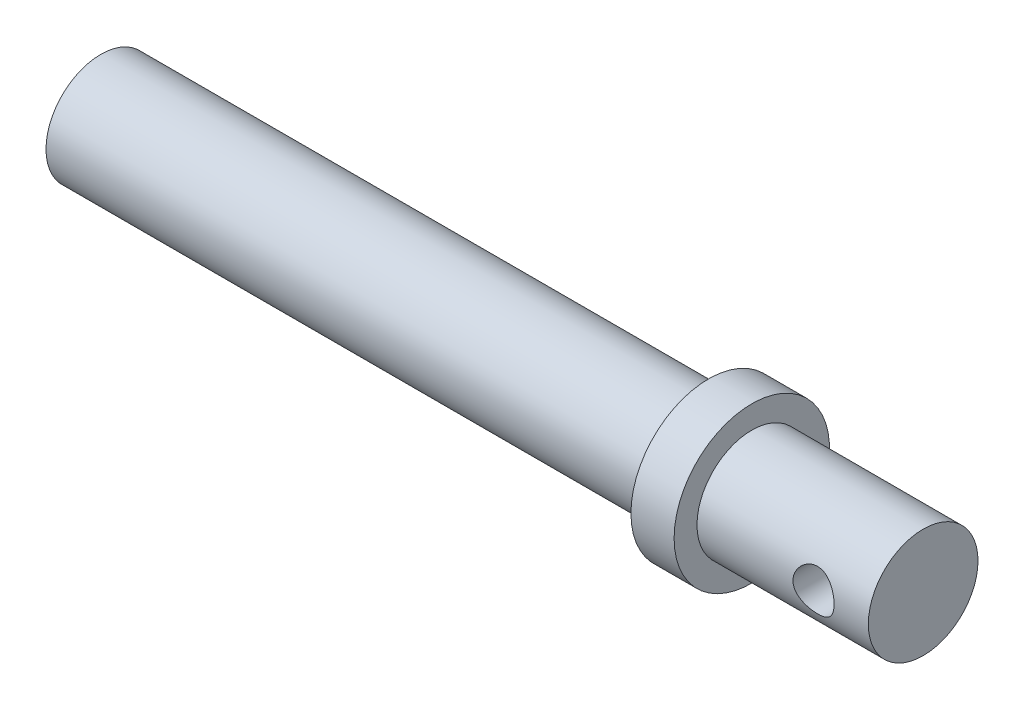
from build123d import *

# Parameters (mm, degrees)
SKETCH1_R               = 6.35
BASE_EXTRUDE_DEPTH      = 95.25
CUT_EXTRUDE1_DEPTH      = 96.672396751
CUT_EXTRUDE1_DEPTH_BACK = 96.672396751
SKETCH2_R               = 2.38125
SKETCH3_R               = 2.38125
CUT_EXTRUDE2_DEPTH      = 25.4
SKETCH4_R               = 9
EXTRUDE1_DEPTH          = 5


with BuildPart() as part:
    # Sketch1 → Base-Extrude (new body)
    with BuildSketch(Plane(origin=(0, 0, 0), x_dir=(0, 0, -1), z_dir=(1, 0, 0))):
        Circle(SKETCH1_R)
    extrude(amount=BASE_EXTRUDE_DEPTH)

    # Sketch2 → Cut-Extrude1 (cut, two sides: drawn at the far end of the back side and taken through both)
    with BuildSketch(Plane.XY.offset(-CUT_EXTRUDE1_DEPTH_BACK)):
        with Locations((88.9, 0)):
            Circle(SKETCH2_R)
    extrude(amount=CUT_EXTRUDE1_DEPTH + CUT_EXTRUDE1_DEPTH_BACK, mode=Mode.SUBTRACT)

    # Sketch3 → Cut-Extrude2 (cut)
    with BuildSketch(Plane.ZY):
        Circle(SKETCH3_R)
    extrude(amount=-CUT_EXTRUDE2_DEPTH, mode=Mode.SUBTRACT)

    # Sketch4 → Extrude1 (add)
    with BuildSketch(Plane.ZY.offset(-70.4)):
        Circle(SKETCH4_R)
    extrude(amount=-EXTRUDE1_DEPTH)


solid = part.part
